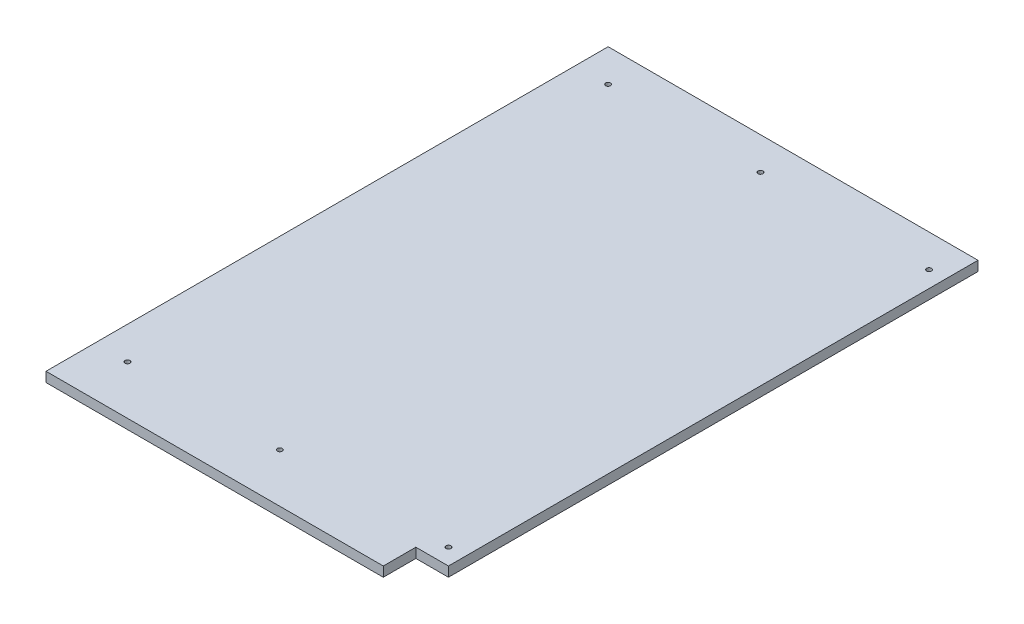
from build123d import *

# Parameters (mm, degrees)
SKETCH_1_R      = 1.5
EXTRUDE_1_DEPTH = 6


with BuildPart() as part:
    # 草图1 → 凸台-拉伸1 (new body)
    with BuildSketch(Plane(origin=(0, 0, 0), x_dir=(1, 0, 0), z_dir=(0, 1, 0))):
        Polygon((-112.725, 113.5), (114.275, 113.5), (114.275, -211.5), (94.275, -211.5), (94.275, -231.5), (-112.725, -231.5), align=None)
        with Locations(Location((-92.725, 93.5, 0), (0, 0, 270))):
            Circle(SKETCH_1_R, mode=Mode.SUBTRACT)
        with Locations(Location((104.275, 93.5, 0), (0, 0, 270))):
            Circle(SKETCH_1_R, mode=Mode.SUBTRACT)
        with Locations(Location((0.775, 93.5, 0), (0, 0, 270))):
            Circle(SKETCH_1_R, mode=Mode.SUBTRACT)
        with Locations(Location((-92.725, -201.5, 0), (0, 0, 270))):
            Circle(SKETCH_1_R, mode=Mode.SUBTRACT)
        with Locations(Location((0.775, -201.5, 0), (0, 0, 270))):
            Circle(SKETCH_1_R, mode=Mode.SUBTRACT)
        with Locations(Location((104.275, -201.5, 0), (0, 0, 270))):
            Circle(SKETCH_1_R, mode=Mode.SUBTRACT)
    extrude(amount=EXTRUDE_1_DEPTH)


solid = part.part
